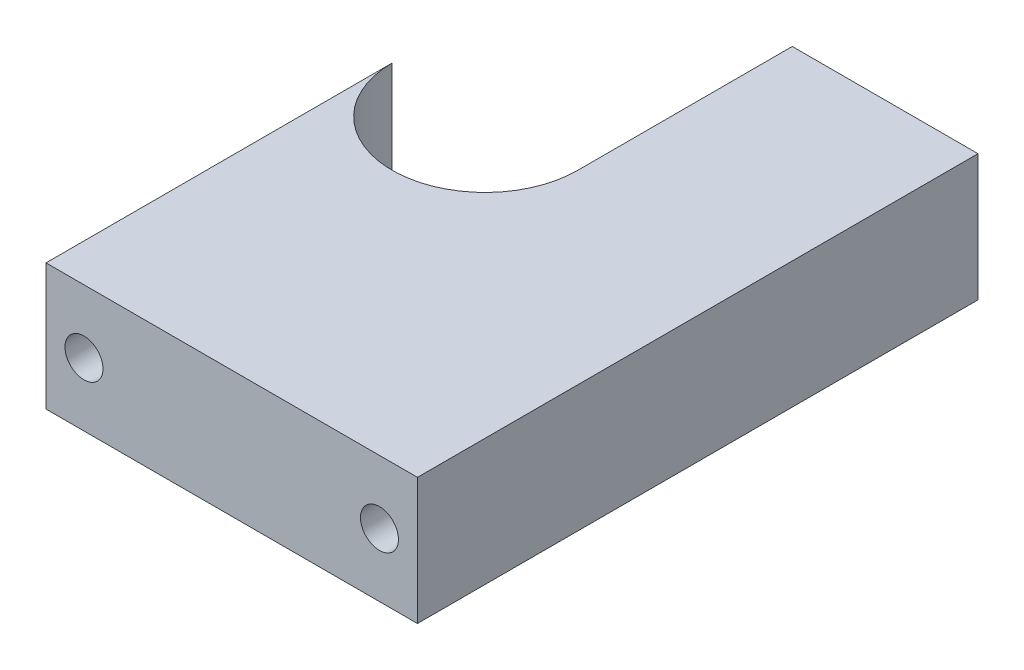
from build123d import *

# Parameters (mm, degrees)
BOSS_EXTRUDE1_DEPTH            = 15
SKETCH11_W                     = 2.25
SKETCH11_H                     = 12.7
M4_CLEARANCE_HOLE5_AT_2_COUNT  = 2
M4_CLEARANCE_HOLE5_AT_2_PITCH  = 35
SKETCH13_W                     = 3.75
SKETCH13_H                     = 53.7
F_6_0MM_DOWEL_HOLE1_AT_2_COUNT = 2
F_6_0MM_DOWEL_HOLE1_AT_2_PITCH = 35


with BuildPart() as part:
    # Sketch1 → Boss-Extrude1 (new body)
    with BuildSketch(Plane(origin=(0, 0, 0), x_dir=(1, 0, 0), z_dir=(0, 1, 0))):
        with BuildLine():
            Line((0, 0), (0, 41))
            ThreePointArc((0, 41), (11, 30), (22, 41))
            Line((22, 41), (22, 66.4))
            Line((22, 66.4), (44, 66.4))
            Line((44, 66.4), (44, 41))
            Line((44, 41), (44, 0))
            Line((44, 0), (0, 0))
        make_face()
    extrude(amount=BOSS_EXTRUDE1_DEPTH)

    # Sketch11 → M4 Clearance Hole5 (revolve, cut)
    with BuildSketch(Plane(origin=(39.5, 7.5, -12.7), x_dir=(0, 1, 0), z_dir=(1, 0, 0))):
        with Locations((1.125, 6.35)):
            Rectangle(SKETCH11_W, SKETCH11_H)
    m4_clearance_hole5 = revolve(axis=Axis((39.5, 7.5, -19.05), (0, 0, 1)), mode=Mode.SUBTRACT)

    # M4 Clearance Hole5 at 2: M4 Clearance Hole5 ×2
    with Locations(*[(-i * M4_CLEARANCE_HOLE5_AT_2_PITCH, 0, 0) for i in range(1, M4_CLEARANCE_HOLE5_AT_2_COUNT)]):
        add(m4_clearance_hole5, mode=Mode.SUBTRACT)

    # Sketch13 → Ø6.0mm Dowel Hole1 (revolve, cut)
    with BuildSketch(Plane(origin=(39.5, 7.5, -12.7), x_dir=(0, -1, 0), z_dir=(1, 0, 0))):
        with Locations((1.875, 26.85)):
            Rectangle(SKETCH13_W, SKETCH13_H)
    f_6_0mm_dowel_hole1 = revolve(axis=Axis((39.5, 7.5, -6.35), (0, 0, -1)), mode=Mode.SUBTRACT)

    # Ø6.0mm Dowel Hole1 at 2: Ø6.0mm Dowel Hole1 ×2
    with Locations(*[(-i * F_6_0MM_DOWEL_HOLE1_AT_2_PITCH, 0, 0) for i in range(1, F_6_0MM_DOWEL_HOLE1_AT_2_COUNT)]):
        add(f_6_0mm_dowel_hole1, mode=Mode.SUBTRACT)


solid = part.part
